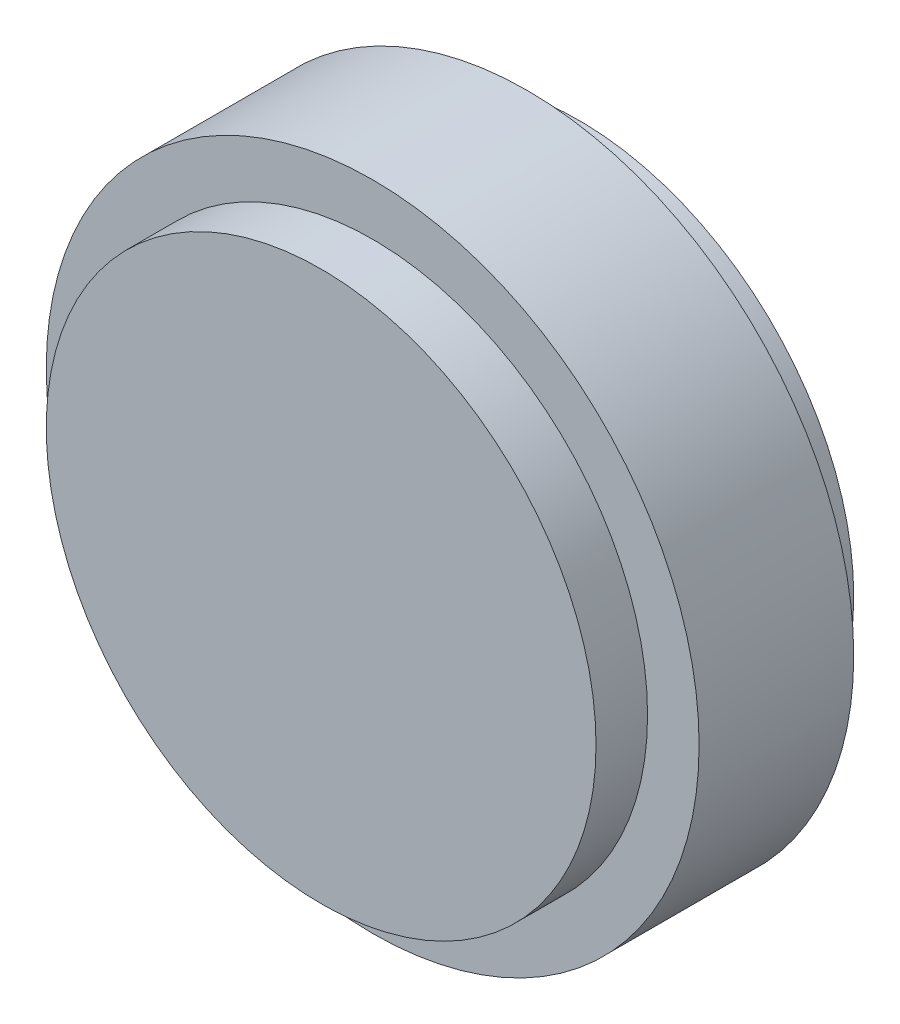
from build123d import *


with BuildPart() as part:
    # Sketch2 → Revolve1 (revolve)
    with BuildSketch(Plane(origin=(0, 0, 0), x_dir=(0, 0, -1), z_dir=(1, 0, 0)), mode=Mode.PRIVATE) as revolve1_sk:
        Polygon((0, 0), (15, 0), (15, 16), (12, 16), (12, 19), (3, 19), (3, 16), (0, 16), align=None)
    revolve(revolve1_sk.sketch.rotate(Axis((0, 0, 0), (0, 0, -1)), 90), axis=Axis((0, 0, 0), (0, 0, -1)))


solid = part.part
